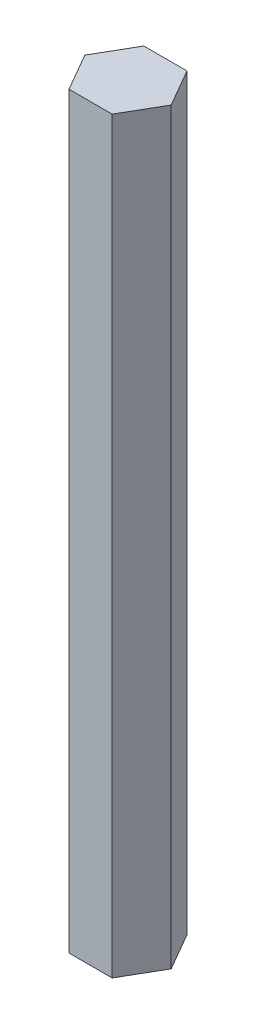
from build123d import *

# Parameters (mm, degrees)
EXTRUDE_1_DEPTH = 30


with BuildPart() as part:
    # 草图1 → 凸台-拉伸1 (new body)
    with BuildSketch(Plane(origin=(0, 0, 0), x_dir=(1, 0, 0), z_dir=(0, 1, 0))):
        Polygon((1.732050808, 0), (0.866025404, 1.5), (-0.866025404, 1.5), (-1.732050808, 0), (-0.866025404, -1.5), (0.866025404, -1.5), align=None)
    extrude(amount=EXTRUDE_1_DEPTH)


solid = part.part
